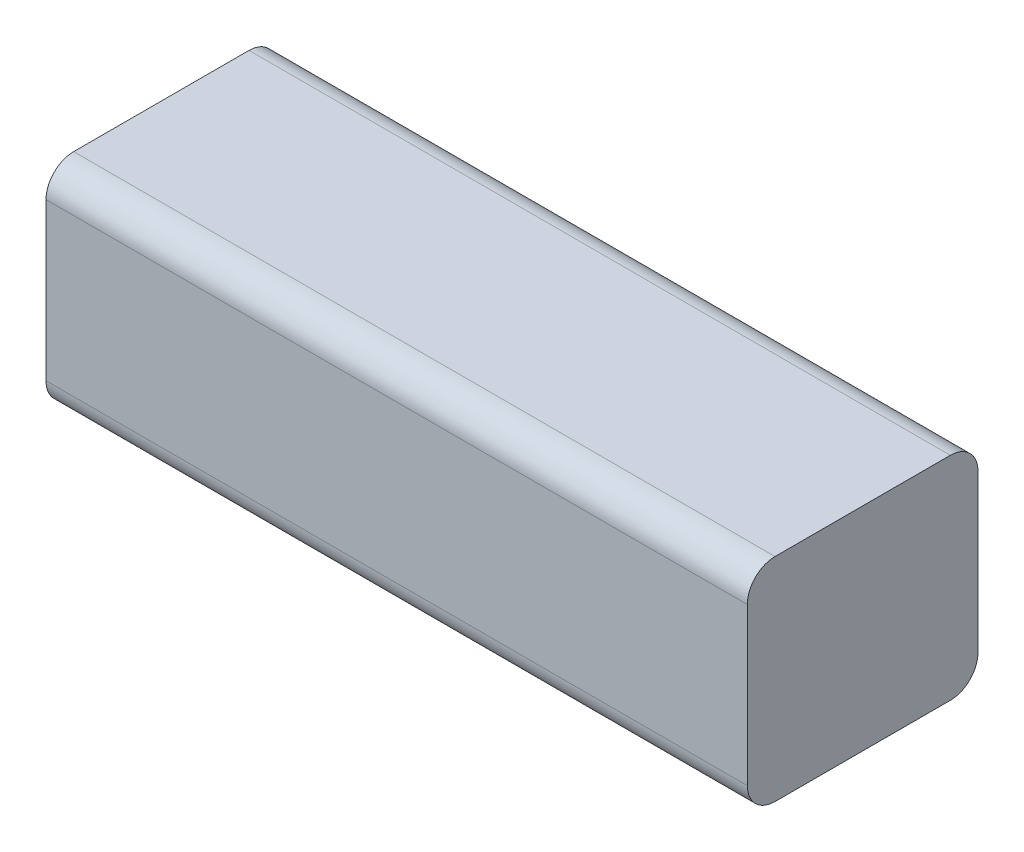
from build123d import *

# Parameters (mm, degrees)
SKETCH1_W           = 76
SKETCH1_H           = 25
BOSS_EXTRUDE1_DEPTH = 23
FILLET1_R           = 3


with BuildPart() as part:
    # Sketch1 → Boss-Extrude1 (new body)
    with BuildSketch(Plane(origin=(0, 0, 0), x_dir=(1, 0, 0), z_dir=(0, 1, 0))):
        Rectangle(SKETCH1_W, SKETCH1_H)
    extrude(amount=BOSS_EXTRUDE1_DEPTH)

    # Fillet1
    fillet1_edges = [part.edges().sort_by_distance(p)[0] for p in [
        (0, 23, 12.5),
        (0, 0, 12.5),
        (0, 0, -12.5),
        (0, 23, -12.5),
    ]]
    fillet(fillet1_edges, radius=FILLET1_R)


solid = part.part
